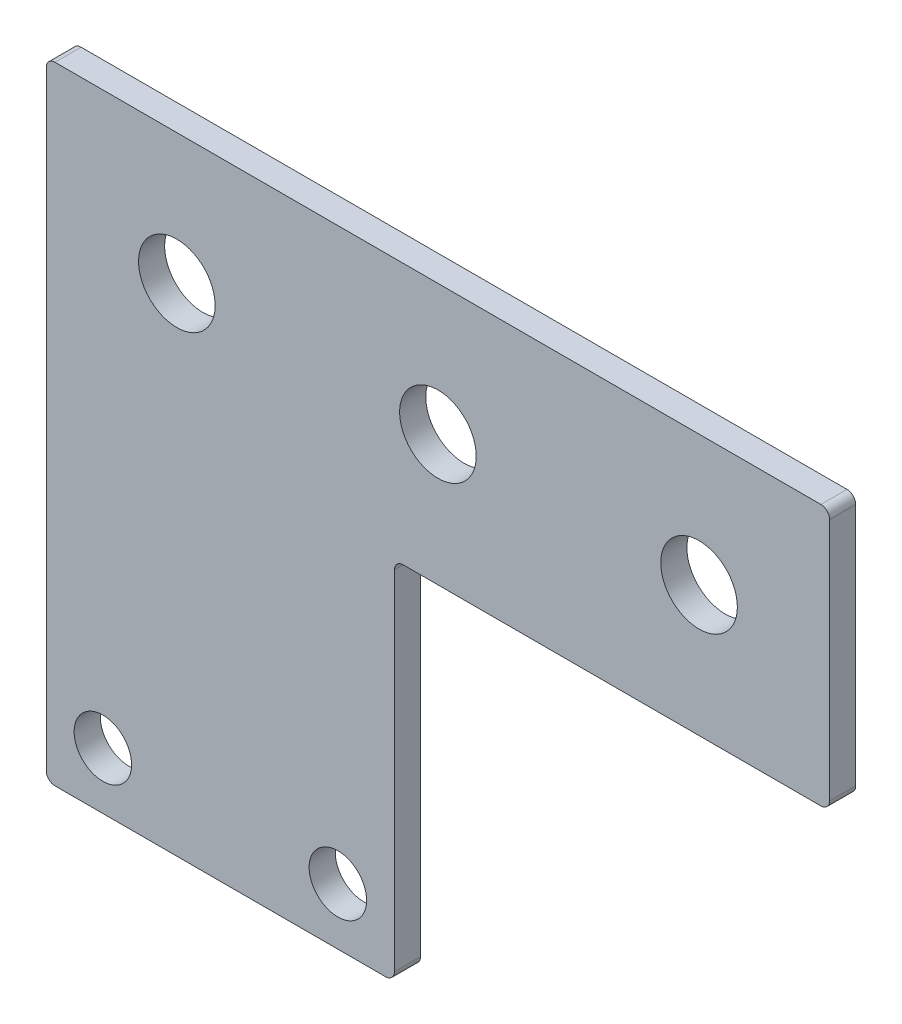
from build123d import *

# Parameters (mm, degrees)
SKETCH_1_R      = 3.3
SKETCH_1_R_2    = 4.4
EXTRUDE_1_DEPTH = 3
FILLET_1_R      = 1


with BuildPart() as part:
    # 草图1 → 凸台-拉伸1 (new body)
    with BuildSketch(Plane.XY):
        Polygon((0, 0), (0, -72), (40, -72), (40, -30), (90, -30), (90, 0), align=None)
        with Locations((33.5, -65.5)):
            Circle(SKETCH_1_R, mode=Mode.SUBTRACT)
        with Locations((6.5, -65.5)):
            Circle(SKETCH_1_R, mode=Mode.SUBTRACT)
        with Locations((45, -15)):
            Circle(SKETCH_1_R_2, mode=Mode.SUBTRACT)
        with Locations((75, -15)):
            Circle(SKETCH_1_R_2, mode=Mode.SUBTRACT)
        with Locations((15, -15)):
            Circle(SKETCH_1_R_2, mode=Mode.SUBTRACT)
    extrude(amount=EXTRUDE_1_DEPTH)

    # 圆角1
    fillet_1_edges = [part.edges().sort_by_distance(p)[0] for p in [
        (90, 0, 1.5),
        (90, -30, 1.5),
        (40, -30, 1.5),
        (40, -72, 1.5),
        (0, -72, 1.5),
        (0, 0, 1.5),
    ]]
    fillet(fillet_1_edges, radius=FILLET_1_R)


solid = part.part
